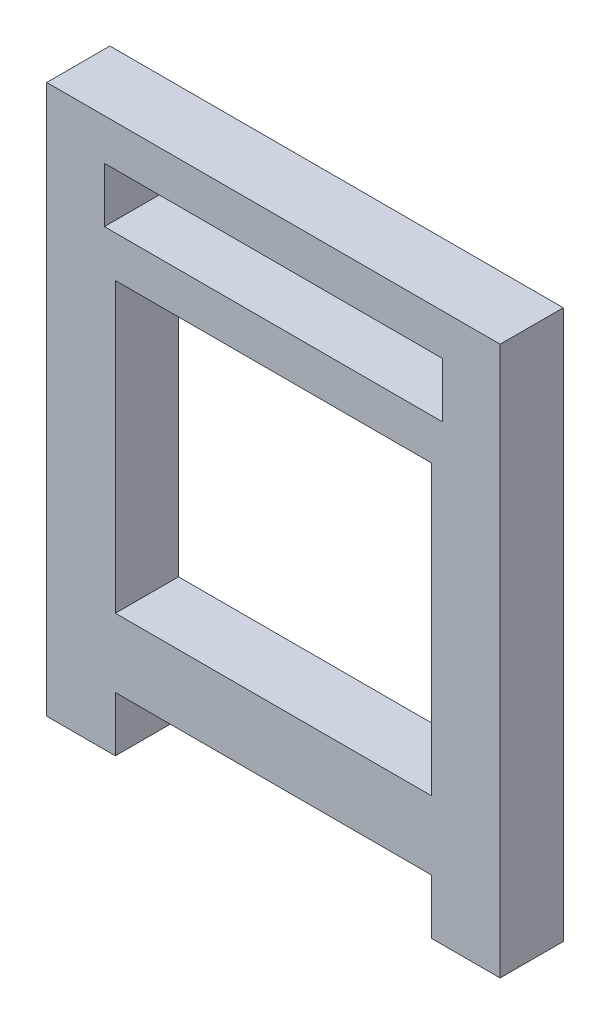
from build123d import *

# Parameters (mm, degrees)
SKETCH1_W           = 11.52
SKETCH1_H           = 10.5
SKETCH1_W_2         = 12.32
SKETCH1_H_2         = 2
BOSS_EXTRUDE1_DEPTH = 2.3


with BuildPart() as part:
    # Sketch1 → Boss-Extrude1 (new body)
    with BuildSketch(Plane.XY):
        Polygon((0, 0), (0, -2), (2.5, -2), (2.5, 0), (14.02, 0), (14.02, -2), (16.52, -2), (16.52, 0), (16.52, 18), (0, 18), align=None)
        with Locations((8.26, 7.75)):
            Rectangle(SKETCH1_W, SKETCH1_H, mode=Mode.SUBTRACT)
        with Locations((8.26, 15.5)):
            Rectangle(SKETCH1_W_2, SKETCH1_H_2, mode=Mode.SUBTRACT)
    extrude(amount=BOSS_EXTRUDE1_DEPTH)


solid = part.part
